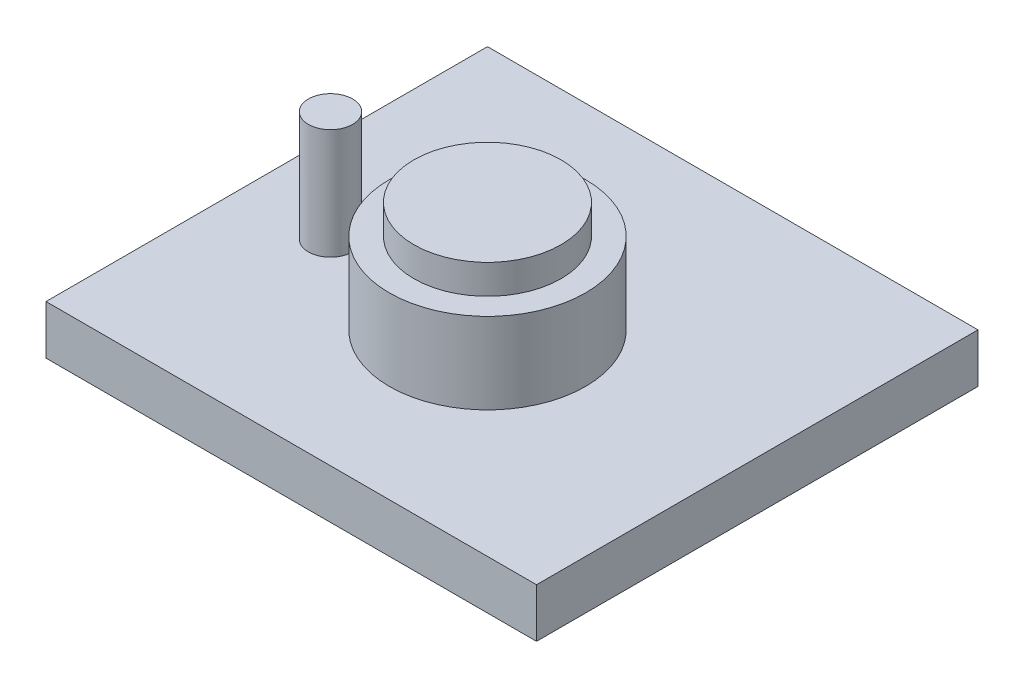
from build123d import *

# Parameters (mm, degrees)
SKETCH4_W           = 50
SKETCH4_H           = 40
BOSS_EXTRUDE1_DEPTH = 5
SKETCH5_R           = 2.25
BOSS_EXTRUDE2_DEPTH = 11.26
SKETCH6_W           = 50
SKETCH6_H           = 5
BOSS_EXTRUDE3_DEPTH = 5


with BuildPart() as part:
    # Sketch3 → Revolve1 (revolve)
    with BuildSketch(Plane.XY, mode=Mode.PRIVATE) as revolve1_sk:
        Polygon((0, 0), (10, 0), (10, 8.26), (7.5, 8.26), (7.5, 11.26), (0, 11.26), align=None)
    revolve(revolve1_sk.sketch.rotate(Axis((0, 11.26, 0), (0, -1, 0)), 180), axis=Axis((0, 11.26, 0), (0, -1, 0)))

    # Sketch4 → Boss-Extrude1 (add)
    with BuildSketch(Plane.XZ):
        Rectangle(SKETCH4_W, SKETCH4_H)
    extrude(amount=BOSS_EXTRUDE1_DEPTH)

    # Sketch5 → Boss-Extrude2 (add)
    with BuildSketch(Plane(origin=(0, 0, 0), x_dir=(1, 0, 0), z_dir=(0, 1, 0))):
        with Locations((-16, 0)):
            Circle(SKETCH5_R)
    extrude(amount=BOSS_EXTRUDE2_DEPTH)

    # Sketch6 → Boss-Extrude3 (add)
    with BuildSketch(Plane(origin=(0, 0, -20), x_dir=(-1, 0, 0), z_dir=(0, 0, -1))):
        with Locations((0, -2.5)):
            Rectangle(SKETCH6_W, SKETCH6_H)
    extrude(amount=BOSS_EXTRUDE3_DEPTH)


solid = part.part
